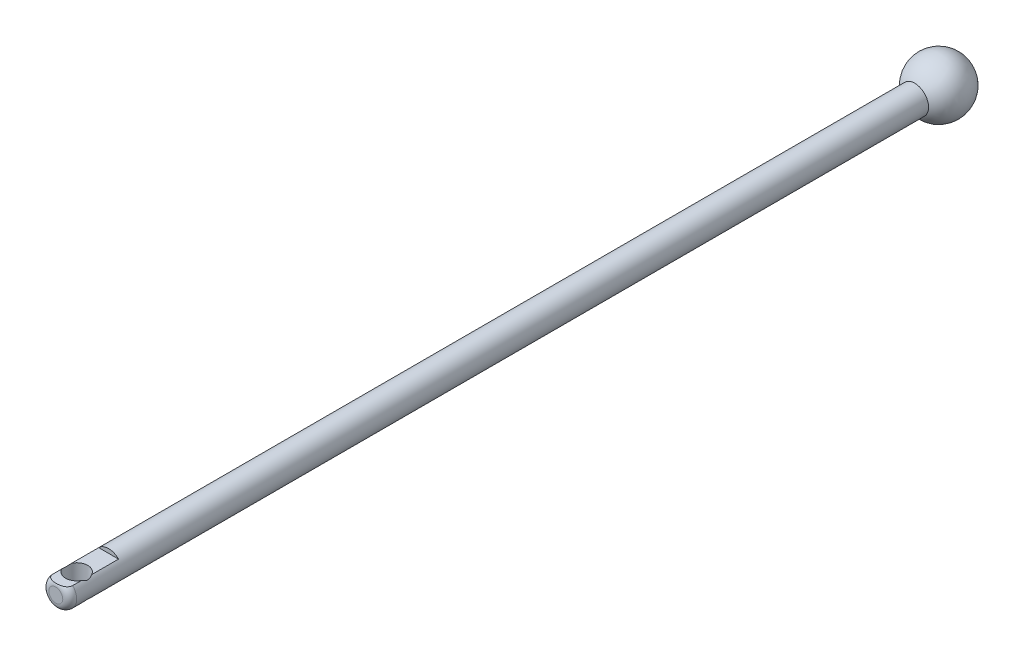
from build123d import *

# Parameters (mm, degrees)
SKETCH1_R               = 1
BOSS_EXTRUDE1_DEPTH     = 65
CUT_EXTRUDE1_DEPTH      = 50
CUT_EXTRUDE1_DEPTH_BACK = 50
SKETCH3_R               = 0.8
FILLET1_R               = 0.5
SKETCH8_W               = 3.288345641
SKETCH8_H               = 4.294982061
CUT_EXTRUDE2_DEPTH      = 0.3


with BuildPart() as part:
    # Sketch1 → Boss-Extrude1 (new body)
    with BuildSketch(Plane.XY):
        with Locations((-5.911296371, 0)):
            Circle(SKETCH1_R)
    extrude(amount=BOSS_EXTRUDE1_DEPTH)

    # Sketch3 → Cut-Extrude1 (cut, two sides: drawn at the far end of the back side and taken through both)
    with BuildSketch(Plane(origin=(0, 0, 0), x_dir=(1, 0, 0), z_dir=(0, 1, 0)).offset(-CUT_EXTRUDE1_DEPTH_BACK)):
        with Locations((-5.911296371, -63.5)):
            Circle(SKETCH3_R)
    extrude(amount=CUT_EXTRUDE1_DEPTH + CUT_EXTRUDE1_DEPTH_BACK, mode=Mode.SUBTRACT)

    # Fillet1
    fillet1_edges = [part.edges().sort_by_distance(p)[0] for p in [
        (-6.911296371, 0, 0),
        (-6.911296371, 0, 65),
    ]]
    fillet(fillet1_edges, radius=FILLET1_R)

    # Sketch8 → Cut-Extrude2 (cut)
    with BuildSketch(Plane(origin=(0, 1, 0), x_dir=(1, 0, 0), z_dir=(0, 1, 0))):
        with Locations((-5.879200856, -63.349684344)):
            Rectangle(SKETCH8_W, SKETCH8_H)
    extrude(amount=-CUT_EXTRUDE2_DEPTH, mode=Mode.SUBTRACT)


with BuildPart() as body_2:
    # Sketch7 → Revolve3 (revolve)
    with BuildSketch(Plane(origin=(0, 0, 0), x_dir=(1, 0, 0), z_dir=(0, 1, 0))):
        with BuildLine():
            Line((-5.911296371, 0.5), (-5.911296371, -3.5))
            ThreePointArc((-5.911296371, -3.5), (-3.911296371, -1.5), (-5.911296371, 0.5))
        make_face()
    revolve(axis=Axis((-5.911296371, 0, -1.712645322), (0, 0, 1)))


solid = Compound([part.part, body_2.part])
